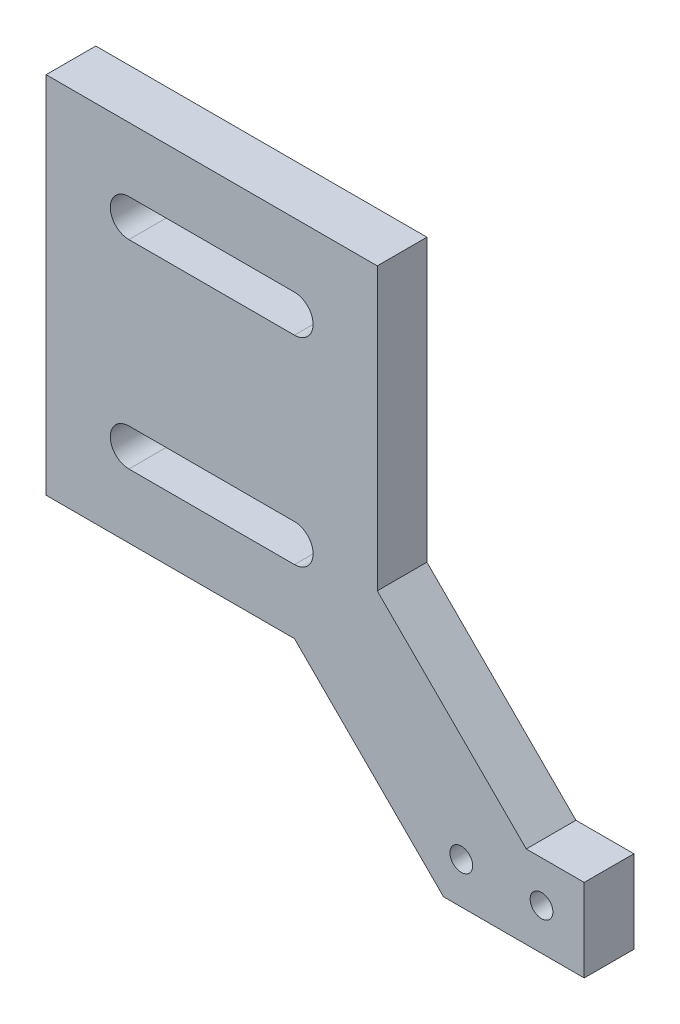
from build123d import *

# Parameters (mm, degrees)
SKETCH1_W           = 40
SKETCH1_H           = 44
BOSS_EXTRUDE1_DEPTH = 6
SKETCH3_R           = 1.375
BOSS_EXTRUDE2_DEPTH = 6


with BuildPart() as part:
    # Sketch1 → Boss-Extrude1 (new body)
    with BuildSketch(Plane.XY):
        Rectangle(SKETCH1_W, SKETCH1_H)
        with BuildLine():
            Line((-10, -9.75), (10, -9.75))
            ThreePointArc((10, -9.75), (12.25, -12), (10, -14.25))
            Line((10, -14.25), (-10, -14.25))
            ThreePointArc((-10, -14.25), (-12.25, -12), (-10, -9.75))
        make_face(mode=Mode.SUBTRACT)
        with BuildLine():
            Line((-10, 14.25), (10, 14.25))
            ThreePointArc((10, 14.25), (12.25, 12), (10, 9.75))
            Line((10, 9.75), (-10, 9.75))
            ThreePointArc((-10, 9.75), (-12.25, 12), (-10, 14.25))
        make_face(mode=Mode.SUBTRACT)
    extrude(amount=BOSS_EXTRUDE1_DEPTH)

    # Sketch3 → Boss-Extrude2 (add)
    with BuildSketch(Plane(origin=(0, 0, 0), x_dir=(-1, 0, 0), z_dir=(0, 0, -1))):
        Polygon((-20, -12), (-38, -30), (-45, -30), (-45, -40), (-28, -40), (-10, -22), (-20, -22), align=None)
        with Locations((-39.845, -35)):
            Circle(SKETCH3_R, mode=Mode.SUBTRACT)
        with Locations((-30.155, -35)):
            Circle(SKETCH3_R, mode=Mode.SUBTRACT)
    extrude(amount=-BOSS_EXTRUDE2_DEPTH)


solid = part.part
